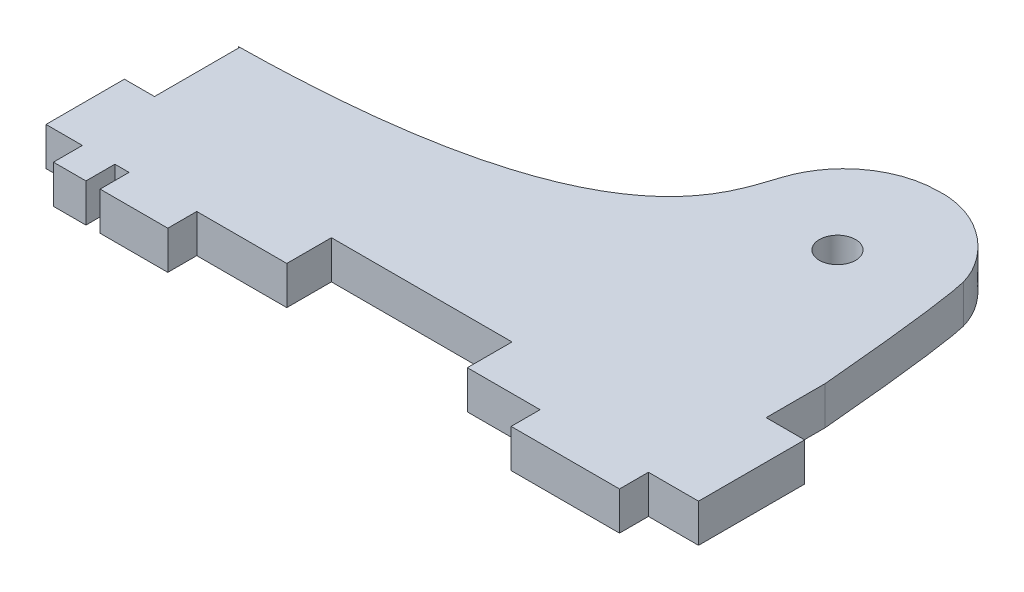
from build123d import *

# Parameters (mm, degrees)
SKETCH1_R           = 1.499976783
BOSS_EXTRUDE1_DEPTH = 3.175


with BuildPart() as part:
    # Sketch1 → Boss-Extrude1 (new body)
    with BuildSketch(Plane(origin=(0, 0, 0), x_dir=(1, 0, 0), z_dir=(0, 1, 0))):
        with BuildLine():
            Line((29.861952869, -5.757321993), (26.667645588, -5.757321993))
            Line((26.667645588, -5.757321993), (26.667645588, -0.857080759))
            add(Edge.make_bspline(
                [(26.667645588, -0.857080759), (25.72356302, 9.922922576), (25.103649505, 12.257419962), (25.095153567, 12.168136444)],
                knots=[3, 3, 3, 3, 4, 4, 4, 4], degree=3))
            add(Edge.make_bspline(
                [(25.095153567, 12.168136444), (24.467255917, 14.632886979), (21.327316795, 17.843284785), (17.583634713, 17.647304435)],
                knots=[4, 4, 4, 4, 5, 5, 5, 5], degree=3))
            add(Edge.make_bspline(
                [(17.583634713, 17.647304435), (14.112817036, 17.647304435), (11.16518444, 15.401572953), (10.109869901, 12.281874779)],
                knots=[5, 5, 5, 5, 6, 6, 6, 6], degree=3))
            add(Edge.make_bspline(
                [(10.109869901, 12.281874779), (8.875160908, 9.099252332), (8.353569729, -0.584552145), (-21.846222224, -0.989511791)],
                knots=[6, 6, 6, 6, 7, 7, 7, 7], degree=3))
            Line((-21.846222224, -0.989511791), (-21.74662038, -0.989511791))
            Line((-21.74662038, -0.989511791), (-21.74662038, -8.05752013))
            Line((-21.74662038, -8.05752013), (-24.242242708, -8.05752013))
            Line((-24.242242708, -8.05752013), (-24.242242708, -14.557549737))
            Line((-24.242242708, -14.557549737), (-21.225926076, -14.557549737))
            Line((-21.225926076, -14.557549737), (-21.225926076, -16.957715728))
            Line((-21.225926076, -16.957715728), (-18.530788103, -16.957715728))
            Line((-18.530788103, -16.957715728), (-18.530788103, -14.557549737))
            Line((-18.530788103, -14.557549737), (-17.354341851, -14.557549737))
            Line((-17.354341851, -14.557549737), (-17.354341851, -16.957715728))
            Line((-17.354341851, -16.957715728), (-11.742742556, -16.957715728))
            Line((-11.742742556, -16.957715728), (-11.742742556, -14.557549737))
            Line((-11.742742556, -14.557549737), (-4.290380881, -14.557549737))
            Line((-4.290380881, -14.557549737), (-4.277541923, -14.557549737))
            Line((-4.277541923, -14.557549737), (-4.277541923, -10.857323134))
            Line((-4.277541923, -10.857323134), (10.695923955, -10.857323134))
            Line((10.695923955, -10.857323134), (10.695923955, -14.557422775))
            Line((10.695923955, -14.557422775), (16.724267817, -14.557422775))
            Line((16.724267817, -14.557422775), (16.724267817, -16.957715728))
            Line((16.724267817, -16.957715728), (25.708547678, -16.957715728))
            Line((25.708547678, -16.957715728), (25.708547678, -14.557549737))
            Line((25.708547678, -14.557549737), (29.861952869, -14.557549737))
            Line((29.861952869, -14.557549737), (29.861952869, -5.757321993))
        make_face()
        with Locations(Location((17.58369808, 9.243227132, 0), (0, 0, 270))):
            Circle(SKETCH1_R, mode=Mode.SUBTRACT)
    extrude(amount=BOSS_EXTRUDE1_DEPTH)


solid = part.part
